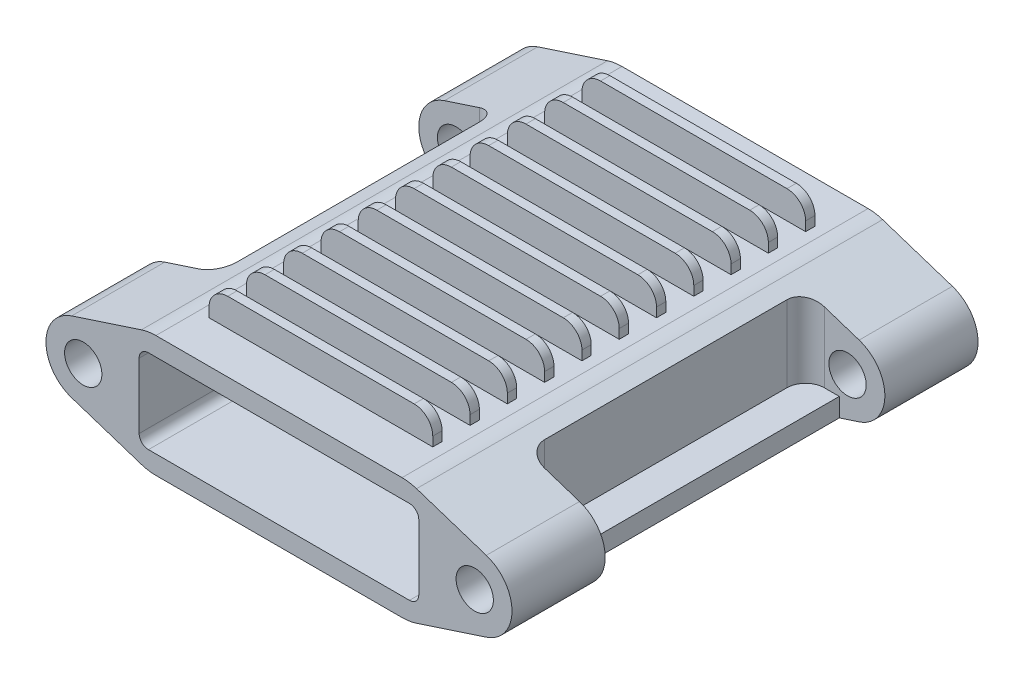
from build123d import *

# Parameters (mm, degrees)
SKETCH1_R           = 2
BOSS_EXTRUDE1_DEPTH = 10
BOSS_EXTRUDE2_DEPTH = 30
SKETCH3_R           = 2
BOSS_EXTRUDE3_DEPTH = 10
SKETCH4_W           = 24
SKETCH4_H           = 1
BOSS_EXTRUDE4_DEPTH = 3
FILLET1_R           = 2
SKETCH5_W           = 24
SKETCH5_H           = 1
BOSS_EXTRUDE5_DEPTH = 3
FILLET2_R           = 2
FILLET3_R           = 2


with BuildPart() as part:
    # Sketch1 → Boss-Extrude1 (new body)
    with BuildSketch(Plane.XY):
        with BuildLine():
            Line((-13.20253534, 6.5), (13.20253534, 6.5))
            ThreePointArc((13.20253534, 6.5), (13.990046548, 6.437593148), (14.757899319, 6.251930439))
            Line((14.757899319, 6.251930439), (22.244291183, 3.801544351))
            ThreePointArc((22.244291183, 3.801544351), (25, 0), (22.244291183, -3.801544351))
            Line((22.244291183, -3.801544351), (14.757899319, -6.251930439))
            ThreePointArc((14.757899319, -6.251930439), (13.990046548, -6.437593148), (13.20253534, -6.5))
            Line((13.20253534, -6.5), (-13.20253534, -6.5))
            ThreePointArc((-13.20253534, -6.5), (-13.990046548, -6.437593148), (-14.757899319, -6.251930439))
            Line((-14.757899319, -6.251930439), (-22.244291183, -3.801544351))
            ThreePointArc((-22.244291183, -3.801544351), (-25, 0), (-22.244291183, 3.801544351))
            Line((-22.244291183, 3.801544351), (-14.757899319, 6.251930439))
            ThreePointArc((-14.757899319, 6.251930439), (-13.990046548, 6.437593148), (-13.20253534, 6.5))
        make_face()
        with Locations((-21, 0)):
            Circle(SKETCH1_R, mode=Mode.SUBTRACT)
        with Locations((21, 0)):
            Circle(SKETCH1_R, mode=Mode.SUBTRACT)
        with BuildLine():
            Line((-14, 4.5), (14, 4.5))
            ThreePointArc((14, 4.5), (14.707106781, 4.207106781), (15, 3.5))
            Line((15, 3.5), (15, -3.5))
            ThreePointArc((15, -3.5), (14.707106781, -4.207106781), (14, -4.5))
            Line((14, -4.5), (-14, -4.5))
            ThreePointArc((-14, -4.5), (-14.707106781, -4.207106781), (-15, -3.5))
            Line((-15, -3.5), (-15, 3.5))
            ThreePointArc((-15, 3.5), (-14.707106781, 4.207106781), (-14, 4.5))
        make_face(mode=Mode.SUBTRACT)
    extrude(amount=BOSS_EXTRUDE1_DEPTH)

    # Sketch2 → Boss-Extrude2 (add)
    with BuildSketch(Plane.XY.offset(10)):
        with BuildLine():
            Line((-16.5, 5.681719935), (-14.757899319, 6.251930439))
            ThreePointArc((-14.757899319, 6.251930439), (-13.990046548, 6.437593148), (-13.20253534, 6.5))
            Line((-13.20253534, 6.5), (13.20253534, 6.5))
            ThreePointArc((13.20253534, 6.5), (13.990046548, 6.437593148), (14.757899319, 6.251930439))
            Line((14.757899319, 6.251930439), (16.5, 5.681719935))
            Line((16.5, 5.681719935), (16.5, -2.5))
            Line((16.5, -2.5), (20.110377383, -2.5))
            Line((20.110377383, -2.5), (20.110377383, -4.5))
            Line((20.110377383, -4.5), (16.5, -4.5))
            Line((16.5, -4.5), (16.5, -5.681719935))
            Line((16.5, -5.681719935), (14.757899319, -6.251930439))
            ThreePointArc((14.757899319, -6.251930439), (13.990046548, -6.437593148), (13.20253534, -6.5))
            Line((13.20253534, -6.5), (-13.20253534, -6.5))
            ThreePointArc((-13.20253534, -6.5), (-13.990046548, -6.437593148), (-14.757899319, -6.251930439))
            Line((-14.757899319, -6.251930439), (-16.5, -5.681719935))
            Line((-16.5, -5.681719935), (-16.5, -4.5))
            Line((-16.5, -4.5), (-20.110377383, -4.5))
            Line((-20.110377383, -4.5), (-20.110377383, -2.5))
            Line((-20.110377383, -2.5), (-16.5, -2.5))
            Line((-16.5, -2.5), (-16.5, 5.681719935))
        make_face()
        with BuildLine():
            Line((-14, 4.5), (14, 4.5))
            ThreePointArc((14, 4.5), (14.707106781, 4.207106781), (15, 3.5))
            Line((15, 3.5), (15, -3.5))
            ThreePointArc((15, -3.5), (14.707106781, -4.207106781), (14, -4.5))
            Line((14, -4.5), (-14, -4.5))
            ThreePointArc((-14, -4.5), (-14.707106781, -4.207106781), (-15, -3.5))
            Line((-15, -3.5), (-15, 3.5))
            ThreePointArc((-15, 3.5), (-14.707106781, 4.207106781), (-14, 4.5))
        make_face(mode=Mode.SUBTRACT)
    extrude(amount=BOSS_EXTRUDE2_DEPTH)

    # Sketch3 → Boss-Extrude3 (add)
    with BuildSketch(Plane.XY.offset(40)):
        with BuildLine():
            Line((-13.20253534, 6.5), (13.20253534, 6.5))
            ThreePointArc((13.20253534, 6.5), (13.990046548, 6.437593148), (14.757899319, 6.251930439))
            Line((14.757899319, 6.251930439), (22.244291183, 3.801544351))
            ThreePointArc((22.244291183, 3.801544351), (25, 0), (22.244291183, -3.801544351))
            Line((22.244291183, -3.801544351), (14.757899319, -6.251930439))
            ThreePointArc((14.757899319, -6.251930439), (13.990046548, -6.437593148), (13.20253534, -6.5))
            Line((13.20253534, -6.5), (-13.20253534, -6.5))
            ThreePointArc((-13.20253534, -6.5), (-13.990046548, -6.437593148), (-14.757899319, -6.251930439))
            Line((-14.757899319, -6.251930439), (-22.244291183, -3.801544351))
            ThreePointArc((-22.244291183, -3.801544351), (-25, 0), (-22.244291183, 3.801544351))
            Line((-22.244291183, 3.801544351), (-14.757899319, 6.251930439))
            ThreePointArc((-14.757899319, 6.251930439), (-13.990046548, 6.437593148), (-13.20253534, 6.5))
        make_face()
        with Locations((-21, 0)):
            Circle(SKETCH3_R, mode=Mode.SUBTRACT)
        with Locations((21, 0)):
            Circle(SKETCH3_R, mode=Mode.SUBTRACT)
        with BuildLine():
            Line((-14, 4.5), (14, 4.5))
            ThreePointArc((14, 4.5), (14.707106781, 4.207106781), (15, 3.5))
            Line((15, 3.5), (15, -3.5))
            ThreePointArc((15, -3.5), (14.707106781, -4.207106781), (14, -4.5))
            Line((14, -4.5), (-14, -4.5))
            ThreePointArc((-14, -4.5), (-14.707106781, -4.207106781), (-15, -3.5))
            Line((-15, -3.5), (-15, 3.5))
            ThreePointArc((-15, 3.5), (-14.707106781, 4.207106781), (-14, 4.5))
        make_face(mode=Mode.SUBTRACT)
    extrude(amount=BOSS_EXTRUDE3_DEPTH)

    # Sketch4 → Boss-Extrude4 (add)
    with BuildSketch(Plane(origin=(0, 6.5, 0), x_dir=(1, 0, 0), z_dir=(0, 1, 0))):
        with Locations((0, -5)):
            Rectangle(SKETCH4_W, SKETCH4_H)
        with Locations((0, -9)):
            Rectangle(SKETCH4_W, SKETCH4_H)
        with Locations((0, -13)):
            Rectangle(SKETCH4_W, SKETCH4_H)
        with Locations((0, -17)):
            Rectangle(SKETCH4_W, SKETCH4_H)
        with Locations((0, -21)):
            Rectangle(SKETCH4_W, SKETCH4_H)
        with Locations((0, -25)):
            Rectangle(SKETCH4_W, SKETCH4_H)
        with Locations((0, -29)):
            Rectangle(SKETCH4_W, SKETCH4_H)
        with Locations((0, -33)):
            Rectangle(SKETCH4_W, SKETCH4_H)
        with Locations((0, -37)):
            Rectangle(SKETCH4_W, SKETCH4_H)
        with Locations((0, -41)):
            Rectangle(SKETCH4_W, SKETCH4_H)
        with Locations((0, -45)):
            Rectangle(SKETCH4_W, SKETCH4_H)
    extrude(amount=BOSS_EXTRUDE4_DEPTH)

    # Fillet1
    fillet1_edges = [part.edges().sort_by_distance(p)[0] for p in [
        (-12, 9.5, 5),
        (12, 9.5, 5),
        (-12, 9.5, 9),
        (12, 9.5, 9),
        (-12, 9.5, 13),
        (12, 9.5, 13),
        (-12, 9.5, 17),
        (12, 9.5, 17),
        (-12, 9.5, 21),
        (12, 9.5, 21),
        (-12, 9.5, 25),
        (12, 9.5, 25),
        (-12, 9.5, 29),
        (12, 9.5, 29),
        (-12, 9.5, 33),
        (12, 9.5, 33),
        (-12, 9.5, 37),
        (12, 9.5, 37),
        (-12, 9.5, 41),
        (12, 9.5, 41),
        (-12, 9.5, 45),
        (12, 9.5, 45),
    ]]
    fillet(fillet1_edges, radius=FILLET1_R)

    # Sketch5 → Boss-Extrude5 (add)
    with BuildSketch(Plane(origin=(0, -6.5, 0), x_dir=(-1, 0, 0), z_dir=(0, -1, 0))):
        with Locations((0, -5)):
            Rectangle(SKETCH5_W, SKETCH5_H)
        with Locations((0, -9)):
            Rectangle(SKETCH5_W, SKETCH5_H)
        with Locations((0, -13)):
            Rectangle(SKETCH5_W, SKETCH5_H)
        with Locations((0, -17)):
            Rectangle(SKETCH5_W, SKETCH5_H)
        with Locations((0, -21)):
            Rectangle(SKETCH5_W, SKETCH5_H)
        with Locations((0, -25)):
            Rectangle(SKETCH5_W, SKETCH5_H)
        with Locations((0, -29)):
            Rectangle(SKETCH5_W, SKETCH5_H)
        with Locations((0, -33)):
            Rectangle(SKETCH5_W, SKETCH5_H)
        with Locations((0, -37)):
            Rectangle(SKETCH5_W, SKETCH5_H)
        with Locations((0, -41)):
            Rectangle(SKETCH5_W, SKETCH5_H)
        with Locations((0, -45)):
            Rectangle(SKETCH5_W, SKETCH5_H)
    extrude(amount=BOSS_EXTRUDE5_DEPTH)

    # Fillet2
    fillet2_edges = [part.edges().sort_by_distance(p)[0] for p in [
        (12, -9.5, 5),
        (-12, -9.5, 5),
        (12, -9.5, 9),
        (-12, -9.5, 9),
        (12, -9.5, 13),
        (-12, -9.5, 13),
        (12, -9.5, 17),
        (-12, -9.5, 17),
        (12, -9.5, 21),
        (-12, -9.5, 21),
        (12, -9.5, 25),
        (-12, -9.5, 25),
        (12, -9.5, 29),
        (-12, -9.5, 29),
        (12, -9.5, 33),
        (-12, -9.5, 33),
        (12, -9.5, 37),
        (-12, -9.5, 37),
        (12, -9.5, 41),
        (-12, -9.5, 41),
        (12, -9.5, 45),
        (-12, -9.5, 45),
    ]]
    fillet(fillet2_edges, radius=FILLET2_R)

    # Fillet3
    fillet3_edges = [part.edges().sort_by_distance(p)[0] for p in [
        (16.5, -5.090859968, 10),
        (-16.5, -5.090859968, 10),
        (-16.5, -5.090859968, 40),
        (16.5, -5.090859968, 40),
        (16.5, 1.590859968, 40),
        (-16.5, 1.590859968, 40),
        (-16.5, 1.590859968, 10),
        (16.5, 1.590859968, 10),
    ]]
    fillet(fillet3_edges, radius=FILLET3_R)


solid = part.part
